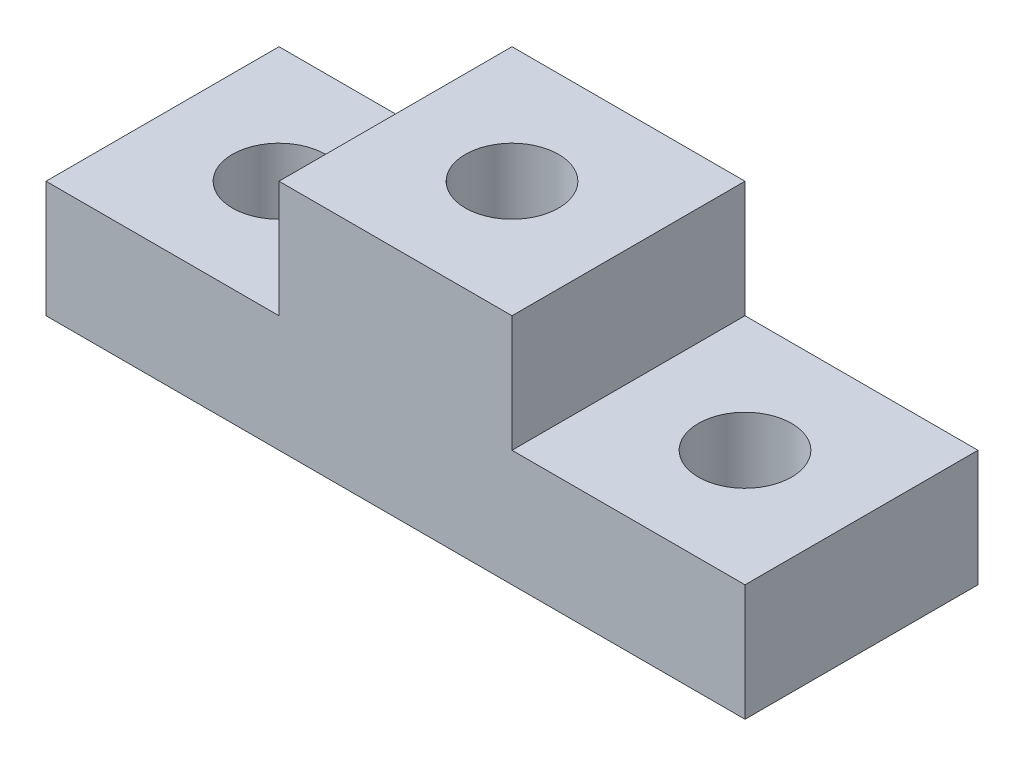
from build123d import *

# Parameters (mm, degrees)
BOSS_EXTRUDE1_DEPTH = 10
SKETCH2_R           = 2
CUT_EXTRUDE1_DEPTH  = 34.166247904
SKETCH3_R           = 2
CUT_EXTRUDE2_DEPTH  = 33.015621187


with BuildPart() as part:
    # Sketch1 → Boss-Extrude1 (new body)
    with BuildSketch(Plane.XY):
        Polygon((10, 0), (20, 0), (20, -5), (30, -5), (30, -10), (0, -10), (0, -5), (10, -5), align=None)
    extrude(amount=BOSS_EXTRUDE1_DEPTH)

    # Sketch2 → Cut-Extrude1 (cut, through all)
    with BuildSketch(Plane(origin=(0, 0, 0), x_dir=(1, 0, 0), z_dir=(0, 1, 0))):
        with Locations(Location((15, -5, 0), (0, 0, 270))):
            Circle(SKETCH2_R)
    extrude(amount=-CUT_EXTRUDE1_DEPTH, mode=Mode.SUBTRACT)

    # Sketch3 → Cut-Extrude2 (cut, through all)
    with BuildSketch(Plane(origin=(0, -5, 0), x_dir=(1, 0, 0), z_dir=(0, 1, 0))):
        with Locations(Location((5, -5, 0), (0, 0, 180))):
            Circle(SKETCH3_R)
        with Locations(Location((25, -5, 0), (0, 0, 180))):
            Circle(SKETCH3_R)
    extrude(amount=-CUT_EXTRUDE2_DEPTH, mode=Mode.SUBTRACT)


solid = part.part
